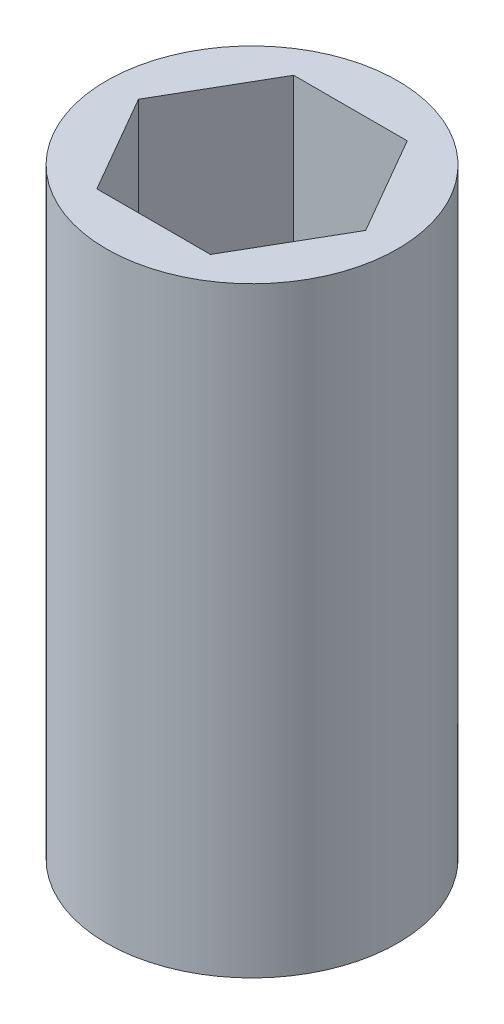
from build123d import *

# Parameters (mm, degrees)
SKETCH1_R           = 7.14375
BOSS_EXTRUDE1_DEPTH = 14.7447


with BuildPart() as part:
    # Sketch1 → Boss-Extrude1 (new, symmetric)
    with BuildSketch(Plane(origin=(0, 0, 0), x_dir=(1, 0, 0), z_dir=(0, 1, 0))):
        with Locations(Location((0, 0, 0), (0, 0, 270))):
            Circle(SKETCH1_R)
        Polygon((2.786292399, -4.826), (5.572584798, 0), (2.786292399, 4.826), (-2.786292399, 4.826), (-5.572584798, 0), (-2.786292399, -4.826), align=None, mode=Mode.SUBTRACT)
    extrude(amount=BOSS_EXTRUDE1_DEPTH, both=True)


solid = part.part
